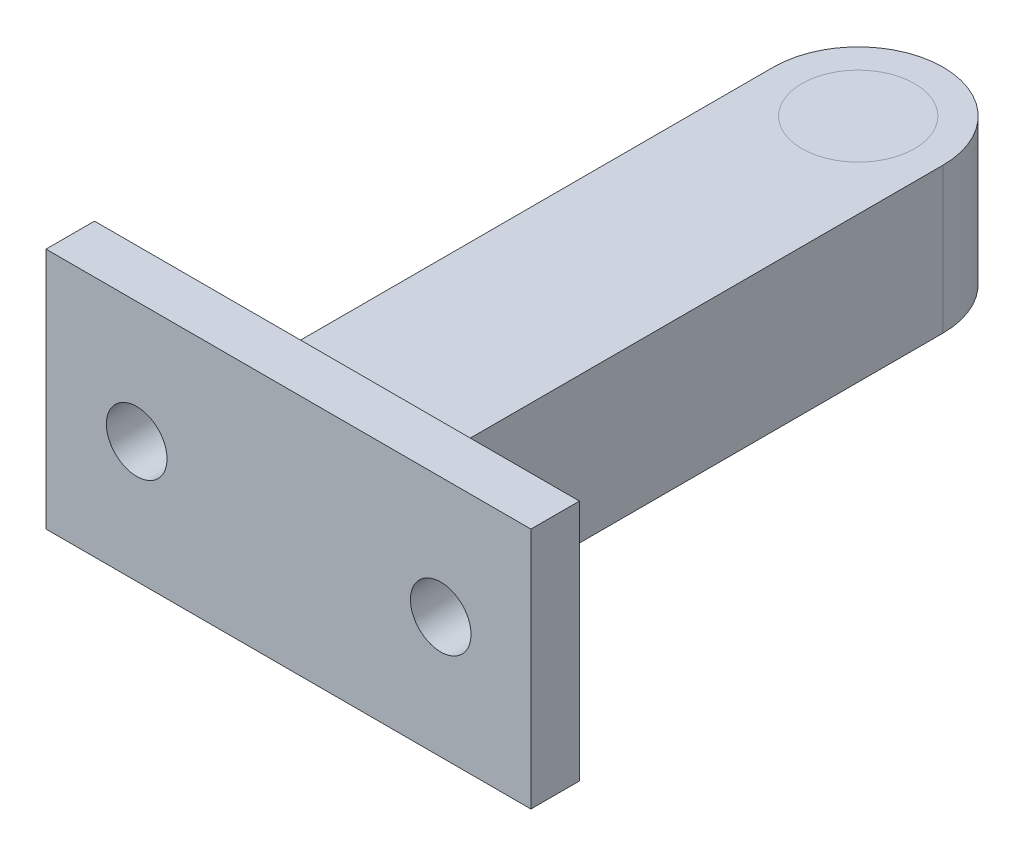
from build123d import *

# Parameters (mm, degrees)
BOSS_EXTRUDE1_DEPTH         = 6
SKETCH2_W                   = 20
SKETCH2_H                   = 10
BOSS_EXTRUDE2_DEPTH         = 2
TAP_DRILL_FOR_M3X0_5_TAP1_D = 2.5
SKETCH5_R                   = 2.325
BOSS_EXTRUDE3_DEPTH         = 0.5


with BuildPart() as part:
    # Sketch1 → Boss-Extrude1 (new body)
    with BuildSketch(Plane(origin=(0, 0, 0), x_dir=(1, 0, 0), z_dir=(0, 1, 0))):
        with BuildLine():
            Line((3.5, -21.5), (3.5, 0))
            ThreePointArc((3.5, 0), (0, -3.5), (-3.5, 0))
            Line((-3.5, 0), (-3.5, -21.5))
            Line((-3.5, -21.5), (3.5, -21.5))
        make_face()
        with BuildLine():
            ThreePointArc((-2.325, 0), (0, 2.325), (2.325, 0))
            Line((2.325, 0), (3.5, 0))
            ThreePointArc((3.5, 0), (0, 3.5), (-3.5, 0))
            Line((-3.5, 0), (-2.325, 0))
        make_face()
        with BuildLine():
            Line((3.5, 0), (2.325, 0))
            ThreePointArc((2.325, 0), (0, -2.325), (-2.325, 0))
            Line((-2.325, 0), (-3.5, 0))
            ThreePointArc((-3.5, 0), (0, -3.5), (3.5, 0))
        make_face()
    extrude(amount=BOSS_EXTRUDE1_DEPTH)

    # Sketch2 → Boss-Extrude2 (add)
    with BuildSketch(Plane.XY.offset(21.5)):
        with Locations((0, 3)):
            Rectangle(SKETCH2_W, SKETCH2_H)
    extrude(amount=BOSS_EXTRUDE2_DEPTH)

    # Tap Drill for M3x0.5 Tap1 (through all)
    with Locations(Plane(origin=(0, 0, 21.5), x_dir=(-1, 0, 0), z_dir=(0, 0, -1))):
        with Locations((6.2576685, 3), (-6.281061653, 3)):
            Hole(TAP_DRILL_FOR_M3X0_5_TAP1_D / 2)


with BuildPart() as body_2:
    # Sketch5 → Boss-Extrude3 (new body)
    with BuildSketch(Plane(origin=(0, 6, 0), x_dir=(1, 0, 0), z_dir=(0, 1, 0))):
        with Locations(Location((0, 0, 0), (0, 0, 270))):
            Circle(SKETCH5_R)
    extrude(amount=-BOSS_EXTRUDE3_DEPTH)


solid = Compound([part.part, body_2.part])
